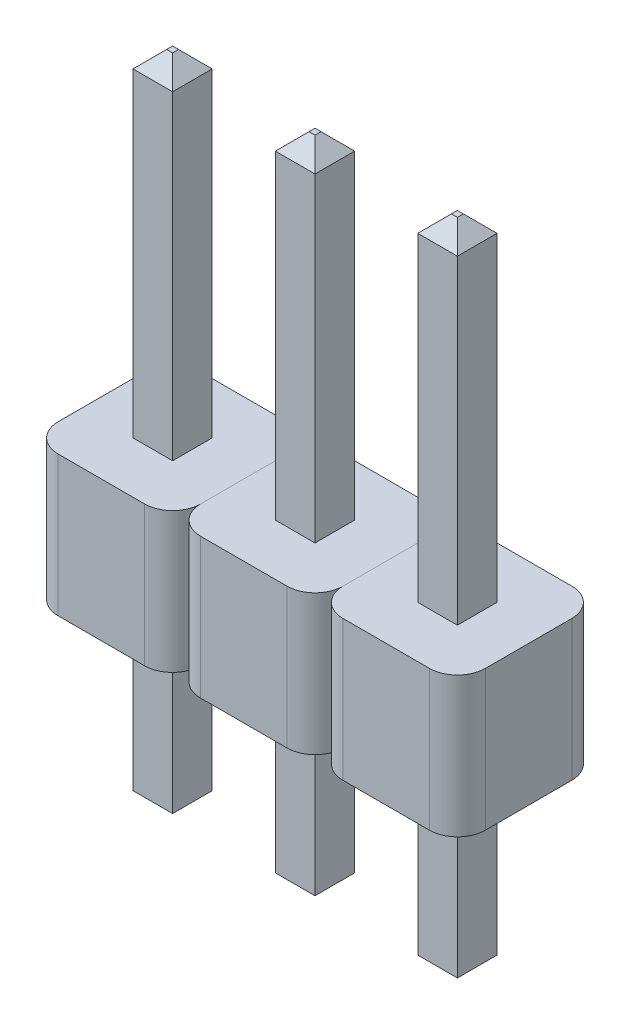
from build123d import *

# Parameters (mm, degrees)
SKETCH1_W                = 2.54
SKETCH1_H                = 2.54
BOSS_EXTRUDE1_DEPTH      = 1.25
FILLET1_R                = 0.5
BOSS_EXTRUDE3_DEPTH      = 3.25
BOSS_EXTRUDE3_DEPTH_BACK = 8.5
SKETCH3_W                = 0.707106782
SKETCH3_H                = 0.707106782
SKETCH4_W                = 0.707106782
SKETCH4_H                = 0.707106782
CUT_EXTRUDE1_DEPTH       = 2.5
CHAMFER3_SIZE            = 0.3
LPATTERN1_COUNT          = 3
LPATTERN1_PITCH          = 2.54


with BuildPart() as part:
    # Sketch1 → Boss-Extrude1 (new, symmetric)
    with BuildSketch(Plane(origin=(0, 0, 0), x_dir=(1, 0, 0), z_dir=(0, 1, 0))):
        Rectangle(SKETCH1_W, SKETCH1_H)
    extrude(amount=BOSS_EXTRUDE1_DEPTH, both=True)

    # Fillet1
    fillet1_edges = [part.edges().sort_by_distance(p)[0] for p in [
        (-1.27, 0, -1.27),
        (1.27, 0, -1.27),
        (-1.27, 0, 1.27),
        (1.27, 0, 1.27),
    ]]
    fillet(fillet1_edges, radius=FILLET1_R)

    # Sketch4 → Cut-Extrude1 (cut)
    with BuildSketch(Plane.XZ.offset(1.25)):
        Rectangle(SKETCH4_W, SKETCH4_H)
    extrude(amount=-CUT_EXTRUDE1_DEPTH, mode=Mode.SUBTRACT)


with BuildPart() as body_2:
    # Sketch3 → Boss-Extrude3 (new, two sides: drawn at the far end of the back side and taken through both)
    with BuildSketch(Plane.XZ.offset(1.25).offset(-BOSS_EXTRUDE3_DEPTH_BACK)):
        Rectangle(SKETCH3_W, SKETCH3_H)
    extrude(amount=BOSS_EXTRUDE3_DEPTH + BOSS_EXTRUDE3_DEPTH_BACK)

    # Chamfer3
    chamfer3_edges = [body_2.edges().sort_by_distance(p)[0] for p in [
        (0, -4.5, 0.353553391),
        (0, 7.25, 0.353553391),
        (-0.353553391, 7.25, 0),
        (0, 7.25, -0.353553391),
        (0.353553391, 7.25, 0),
        (0, -4.5, -0.353553391),
        (-0.353553391, -4.5, 0),
        (0.353553391, -4.5, 0),
    ]]
    chamfer(chamfer3_edges, length=CHAMFER3_SIZE)


with BuildPart() as lpattern1_1:
    # LPattern1: pattern copy
    add(part.part.moved(Location(Vector(1, 0, 0) * (1 * LPATTERN1_PITCH))))


with BuildPart() as lpattern1_2:
    # LPattern1: pattern copy
    add(part.part.moved(Location(Vector(1, 0, 0) * (2 * LPATTERN1_PITCH))))


with BuildPart() as lpattern1_3:
    # LPattern1: pattern copy
    add(body_2.part.moved(Location(Vector(1, 0, 0) * (1 * LPATTERN1_PITCH))))


with BuildPart() as lpattern1_4:
    # LPattern1: pattern copy
    add(body_2.part.moved(Location(Vector(1, 0, 0) * (2 * LPATTERN1_PITCH))))


solid = Compound([part.part, body_2.part, lpattern1_1.part, lpattern1_2.part, lpattern1_3.part, lpattern1_4.part])
